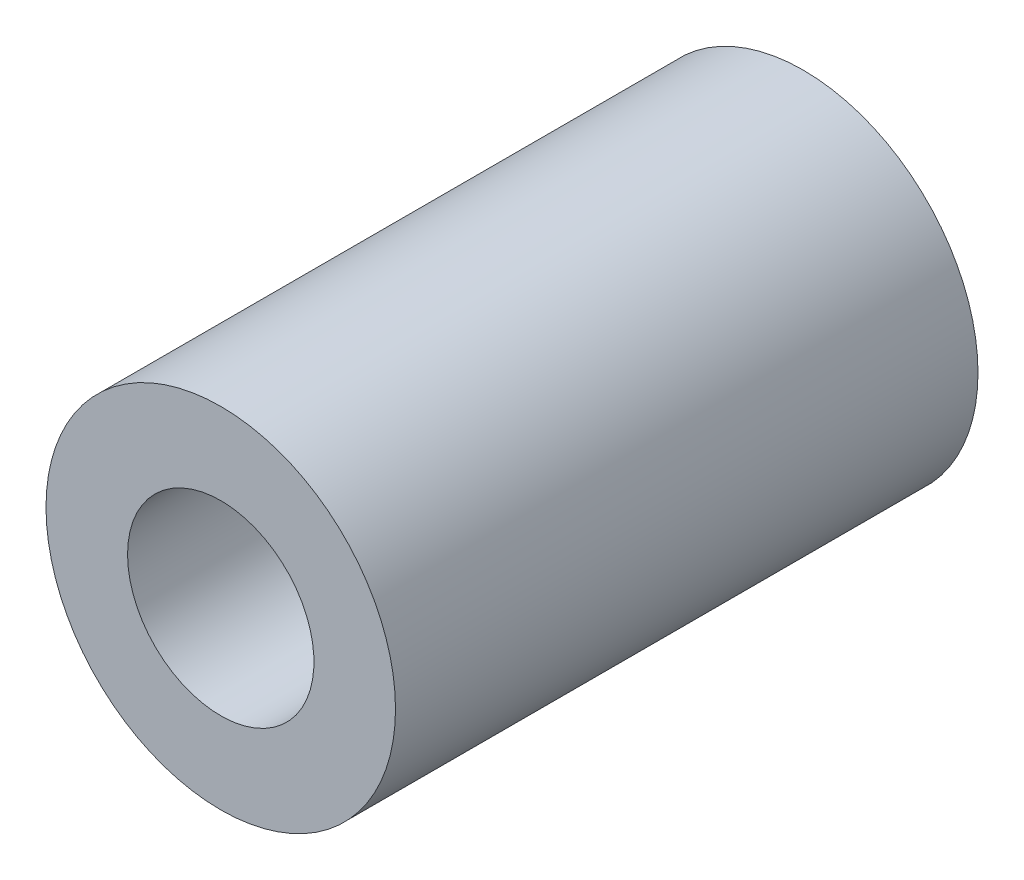
from build123d import *

# Parameters (mm, degrees)
SKETCH_310_R        = 3
EXTRUDE_355_DEPTH   = 10
SKETCH_1_R          = 1.6
CUT_EXTRUDE_1_DEPTH = 11.862780491


with BuildPart() as part:
    # Sketch 310 → Extrude 355 (new body)
    with BuildSketch(Plane.XY):
        Circle(SKETCH_310_R)
    extrude(amount=EXTRUDE_355_DEPTH)

    # ｽｹｯﾁ1 → ｶｯﾄ - 押し出し1 (cut, through all)
    with BuildSketch(Plane(origin=(0, 0, 0), x_dir=(-1, 0, 0), z_dir=(0, 0, -1))):
        Circle(SKETCH_1_R)
    extrude(amount=-CUT_EXTRUDE_1_DEPTH, mode=Mode.SUBTRACT)


solid = part.part
